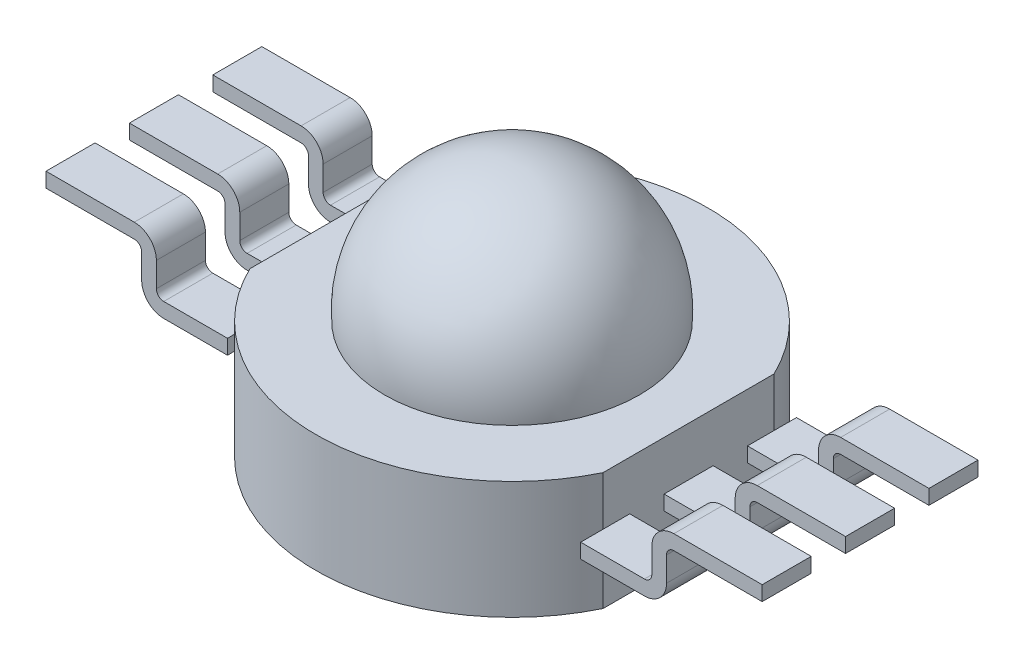
from build123d import *

# Parameters (mm, degrees)
LED_BASE_BOSS_EXTRUDE1_DEPTH                   = 2.4
PIN_RIGHT_BOSS_EXTRUDE2_DEPTH                  = 2.2
PIN_RIGHT_SPACE_CUT_EXTRUDE1_REACH             = 11.15
SKETCH5_W                                      = 3.7
SKETCH5_H                                      = 0.7
PIN_RIGHT_SPACE_CUT_EXTRUDE1_DIRECTION_2_REACH = 11.15
SKETCH6_R                                      = 2.7
HEATSINK_BOSS_EXTRUDE3_DEPTH                   = 0.1


with BuildPart() as part:
    # Sketch1 → LED Base Boss-Extrude1 (new body)
    with BuildSketch(Plane(origin=(0, 0, 0), x_dir=(1, 0, 0), z_dir=(0, 1, 0))):
        with BuildLine():
            Line((-3.6, 1.743559577), (-3.6, -1.743559577))
            ThreePointArc((-3.6, -1.743559577), (0, -4), (3.6, -1.743559577))
            Line((3.6, -1.743559577), (3.6, 1.743559577))
            ThreePointArc((3.6, 1.743559577), (0, 4), (-3.6, 1.743559577))
        make_face()
    extrude(amount=LED_BASE_BOSS_EXTRUDE1_DEPTH)

    # Sketch3 → LED Lens Revolve2 (revolve)
    with BuildSketch(Plane.XY):
        with BuildLine():
            Line((2.6, 2.4), (0, 2.4))
            Line((0, 2.4), (0, 5.2))
            ThreePointArc((0, 5.2), (1.910497317, 4.366890366), (2.6, 2.4))
        make_face()
    revolve(axis=Axis((0, 5.2, 0), (0, -1, 0)))

    # Sketch4 → Pin Right Boss-Extrude2 (add, symmetric)
    with BuildSketch(Plane.XY):
        with BuildLine():
            Line((3.6, 1.4), (4.9, 1.4))
            ThreePointArc((4.9, 1.4), (5.006066017, 1.443933983), (5.05, 1.55))
            Line((5.05, 1.55), (5.05, 2.05))
            ThreePointArc((5.05, 2.05), (5.181801948, 2.368198052), (5.5, 2.5))
            Line((5.5, 2.5), (7.3, 2.5))
            Line((7.3, 2.5), (7.3, 2.2))
            Line((7.3, 2.2), (5.5, 2.2))
            ThreePointArc((5.5, 2.2), (5.393933983, 2.156066017), (5.35, 2.05))
            Line((5.35, 2.05), (5.35, 1.55))
            ThreePointArc((5.35, 1.55), (5.218198052, 1.231801948), (4.9, 1.1))
            Line((4.9, 1.1), (3.6, 1.1))
            Line((3.6, 1.1), (3.6, 1.4))
        make_face()
    pin_right_boss_extrude2 = extrude(amount=PIN_RIGHT_BOSS_EXTRUDE2_DEPTH, both=True)

    # Pin Right Space Cut-Extrude1: up to this face of the body (flat: up to its plane)
    pin_right_space_cut_extrude1_end = Plane(part.part.faces().sort_by_distance((6.4, 2.5, 0))[0])
    # Sketch5 → Pin Right Space Cut-Extrude1 (cut, up to the picked face)
    with BuildSketch(Plane(origin=(0, 1.4, 0), x_dir=(1, 0, 0), z_dir=(0, 1, 0)), mode=Mode.PRIVATE) as pin_right_space_cut_extrude1_sk1:
        with Locations((5.45, 0.85)):
            Rectangle(SKETCH5_W, SKETCH5_H)
    pin_right_space_cut_extrude1_tool1 = split(extrude(pin_right_space_cut_extrude1_sk1.sketch, amount=PIN_RIGHT_SPACE_CUT_EXTRUDE1_REACH, mode=Mode.PRIVATE), bisect_by=pin_right_space_cut_extrude1_end, keep=Keep.BOTH, mode=Mode.PRIVATE)
    # Sketch5 → Pin Right Space Cut-Extrude1 (cut, up to the picked face)
    with BuildSketch(Plane(origin=(0, 1.4, 0), x_dir=(1, 0, 0), z_dir=(0, 1, 0)), mode=Mode.PRIVATE) as pin_right_space_cut_extrude1_sk2:
        with Locations((5.45, -0.85)):
            Rectangle(SKETCH5_W, SKETCH5_H)
    pin_right_space_cut_extrude1_tool2 = split(extrude(pin_right_space_cut_extrude1_sk2.sketch, amount=PIN_RIGHT_SPACE_CUT_EXTRUDE1_REACH, mode=Mode.PRIVATE), bisect_by=pin_right_space_cut_extrude1_end, keep=Keep.BOTH, mode=Mode.PRIVATE)
    pin_right_space_cut_extrude1_1 = pin_right_space_cut_extrude1_tool1.solids().sort_by(Axis((5.45, 1.4, -0.85), (0, 1, 0)))[0]
    add(pin_right_space_cut_extrude1_1, mode=Mode.SUBTRACT)
    pin_right_space_cut_extrude1_2 = pin_right_space_cut_extrude1_tool2.solids().sort_by(Axis((5.45, 1.4, 0.85), (0, 1, 0)))[0]
    add(pin_right_space_cut_extrude1_2, mode=Mode.SUBTRACT)
    pin_right_space_cut_extrude1 = pin_right_space_cut_extrude1_1 + pin_right_space_cut_extrude1_2  # Pin Right Space Cut-Extrude1 as one shape, for the pattern or mirror that repeats it

    # Pin Right Space Cut-Extrude1 direction 2: up to this face of the body (flat: up to its plane)
    pin_right_space_cut_extrude1_direction_2_end = Plane(part.part.faces().sort_by_distance((4.25, 1.1, 0))[0])
    # Sketch5 → Pin Right Space Cut-Extrude1 direction 2 (cut, up to the picked face)
    with BuildSketch(Plane(origin=(0, 1.4, 0), x_dir=(1, 0, 0), z_dir=(0, 1, 0)), mode=Mode.PRIVATE) as pin_right_space_cut_extrude1_direction_2_sk1:
        with Locations((5.45, 0.85)):
            Rectangle(SKETCH5_W, SKETCH5_H)
    pin_right_space_cut_extrude1_direction_2_tool1 = split(extrude(pin_right_space_cut_extrude1_direction_2_sk1.sketch, amount=-PIN_RIGHT_SPACE_CUT_EXTRUDE1_DIRECTION_2_REACH, mode=Mode.PRIVATE), bisect_by=pin_right_space_cut_extrude1_direction_2_end, keep=Keep.BOTH, mode=Mode.PRIVATE)
    # Sketch5 → Pin Right Space Cut-Extrude1 direction 2 (cut, up to the picked face)
    with BuildSketch(Plane(origin=(0, 1.4, 0), x_dir=(1, 0, 0), z_dir=(0, 1, 0)), mode=Mode.PRIVATE) as pin_right_space_cut_extrude1_direction_2_sk2:
        with Locations((5.45, -0.85)):
            Rectangle(SKETCH5_W, SKETCH5_H)
    pin_right_space_cut_extrude1_direction_2_tool2 = split(extrude(pin_right_space_cut_extrude1_direction_2_sk2.sketch, amount=-PIN_RIGHT_SPACE_CUT_EXTRUDE1_DIRECTION_2_REACH, mode=Mode.PRIVATE), bisect_by=pin_right_space_cut_extrude1_direction_2_end, keep=Keep.BOTH, mode=Mode.PRIVATE)
    pin_right_space_cut_extrude1_direction_2_1 = pin_right_space_cut_extrude1_direction_2_tool1.solids().sort_by(Axis((5.45, 1.4, -0.85), (0, -1, 0)))[0]
    add(pin_right_space_cut_extrude1_direction_2_1, mode=Mode.SUBTRACT)
    pin_right_space_cut_extrude1_direction_2_2 = pin_right_space_cut_extrude1_direction_2_tool2.solids().sort_by(Axis((5.45, 1.4, 0.85), (0, -1, 0)))[0]
    add(pin_right_space_cut_extrude1_direction_2_2, mode=Mode.SUBTRACT)
    pin_right_space_cut_extrude1_direction_2 = pin_right_space_cut_extrude1_direction_2_1 + pin_right_space_cut_extrude1_direction_2_2  # Pin Right Space Cut-Extrude1 direction 2 as one shape, for the pattern or mirror that repeats it

    # Pin Left Mirror1: Pin Right Boss-Extrude2, Pin Right Space Cut-Extrude1, Pin Right Space Cut-Extrude1 direction 2 across plane
    add(pin_right_boss_extrude2.mirror(Plane(origin=(0, 0, 0), x_dir=(0, 0, 1), z_dir=(1, 0, 0))))
    add(pin_right_space_cut_extrude1.mirror(Plane(origin=(0, 0, 0), x_dir=(0, 0, 1), z_dir=(1, 0, 0))), mode=Mode.SUBTRACT)
    add(pin_right_space_cut_extrude1_direction_2.mirror(Plane(origin=(0, 0, 0), x_dir=(0, 0, 1), z_dir=(1, 0, 0))), mode=Mode.SUBTRACT)

    # Sketch6 → Heatsink Boss-Extrude3 (add)
    with BuildSketch(Plane.XZ):
        Circle(SKETCH6_R)
    extrude(amount=HEATSINK_BOSS_EXTRUDE3_DEPTH)


solid = part.part
